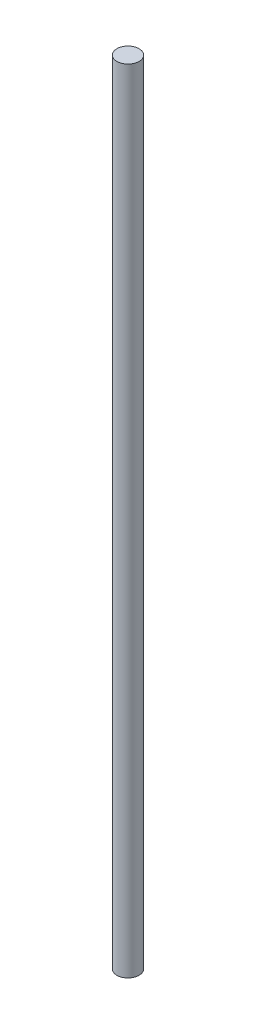
from build123d import *

# Parameters (mm, degrees)
SKETCH1_R           = 14
BOSS_EXTRUDE1_DEPTH = 1000


with BuildPart() as part:
    # Sketch1 → Boss-Extrude1 (new body)
    with BuildSketch(Plane(origin=(0, 0, 0), x_dir=(1, 0, 0), z_dir=(0, 1, 0))):
        with Locations(Location((0, 0, 0), (0, 0, 270))):
            Circle(SKETCH1_R)
    extrude(amount=BOSS_EXTRUDE1_DEPTH)


solid = part.part
